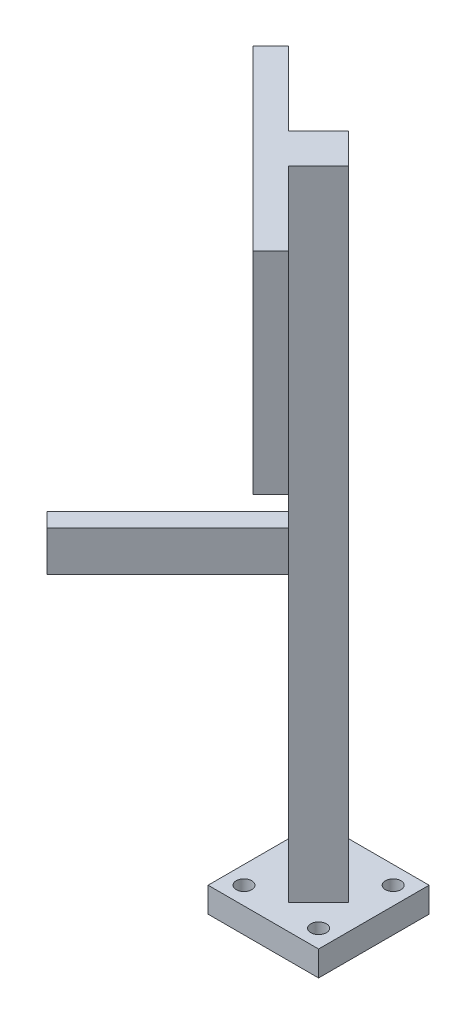
from build123d import *

# Parameters (mm, degrees)
SKETCH_1_W          = 22
SKETCH_1_H          = 22
SKETCH_1_R          = 1.55
EXTRUDE_1_DEPTH     = 5
EXTRUDE_2_DEPTH     = 127
SKETCH_3_W          = 4
SKETCH_3_H          = 8
EXTRUDE_3_DEPTH     = 34
EXTRUDE_4_DEPTH     = 5
SKETCH_7_W          = 3.1
SKETCH_7_H          = 40
CUT_EXTRUDE_3_DEPTH = 5


with BuildPart() as part:
    # 草图1 → 凸台-拉伸1 (new body)
    with BuildSketch(Plane(origin=(0, 0, 0), x_dir=(1, 0, 0), z_dir=(0, 1, 0))):
        Rectangle(SKETCH_1_W, SKETCH_1_H)
        with Locations(Location((-7.424621202, 7.424621202, 0), (0, 0, 270))):
            Circle(SKETCH_1_R, mode=Mode.SUBTRACT)
        with Locations(Location((7.424621202, 7.424621202, 0), (0, 0, 270))):
            Circle(SKETCH_1_R, mode=Mode.SUBTRACT)
        with Locations(Location((7.424621202, -7.424621202, 0), (0, 0, 270))):
            Circle(SKETCH_1_R, mode=Mode.SUBTRACT)
        with Locations(Location((-7.424621202, -7.424621202, 0), (0, 0, 270))):
            Circle(SKETCH_1_R, mode=Mode.SUBTRACT)
    extrude(amount=EXTRUDE_1_DEPTH)

    # 草图2 → 凸台-拉伸2 (add)
    with BuildSketch(Plane(origin=(0, 5, 0), x_dir=(1, 0, 0), z_dir=(0, 1, 0))):
        Polygon((0, 6), (-6, 0), (0, -6), (6, 0), align=None)
    extrude(amount=EXTRUDE_2_DEPTH)

    # 草图3 → 凸台-拉伸3 (add)
    with BuildSketch(Plane(origin=(-3, 0, 3), x_dir=(0.7071067811865452, 0, 0.7071067811865498), z_dir=(-0.7071067811865498, 0, 0.7071067811865452))):
        with Locations((0, 64)):
            Rectangle(SKETCH_3_W, SKETCH_3_H)
    extrude(amount=EXTRUDE_3_DEPTH)

    # 草图4 → 凸台-拉伸4 (add)
    with BuildSketch(Plane(origin=(-3, 0, 3), x_dir=(0.7071067811865452, 0, 0.7071067811865498), z_dir=(-0.7071067811865498, 0, 0.7071067811865452))):
        Polygon((4.242640687, 132), (25, 132), (25, 90), (-25, 90), (-25, 132), align=None)
    extrude(amount=EXTRUDE_4_DEPTH)

    # 草图7 → 切除-拉伸3 (cut)
    with BuildSketch(Plane(origin=(-6.535533906, 0, 6.535533906), x_dir=(0.7071067811865454, 0, 0.7071067811865498), z_dir=(-0.7071067811865498, 0, 0.7071067811865454))):
        with Locations((-14.73, 111)):
            Rectangle(SKETCH_7_W, SKETCH_7_H)
        with Locations((14.73, 111)):
            Rectangle(SKETCH_7_W, SKETCH_7_H)
    extrude(amount=-CUT_EXTRUDE_3_DEPTH, mode=Mode.SUBTRACT)


solid = part.part
